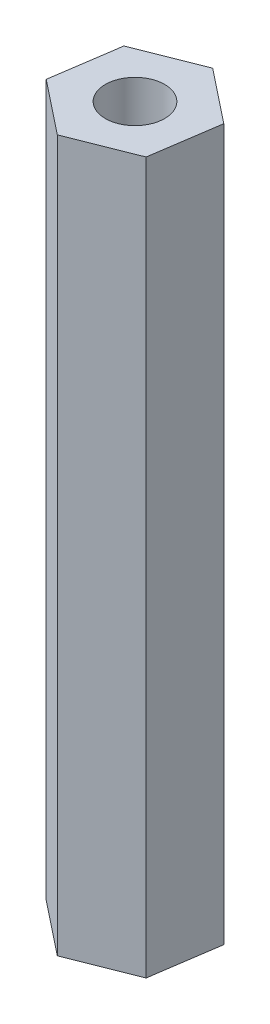
from build123d import *

# Parameters (mm, degrees)
SKETCH1_R           = 1.5
BOSS_EXTRUDE1_DEPTH = 36


with BuildPart() as part:
    # Sketch1 → Boss-Extrude1 (new body)
    with BuildSketch(Plane(origin=(0, 0, 0), x_dir=(1, 0, 0), z_dir=(0, 1, 0))):
        Polygon((2.716014407, -2.150178072), (3.220116037, 1.277048437), (0.50410163, 3.427226509), (-2.716014407, 2.150178072), (-3.220116037, -1.277048437), (-0.50410163, -3.427226509), align=None)
        with Locations(Location((0, 0, 0), (0, 0, 270))):
            Circle(SKETCH1_R, mode=Mode.SUBTRACT)
    extrude(amount=BOSS_EXTRUDE1_DEPTH)


solid = part.part
